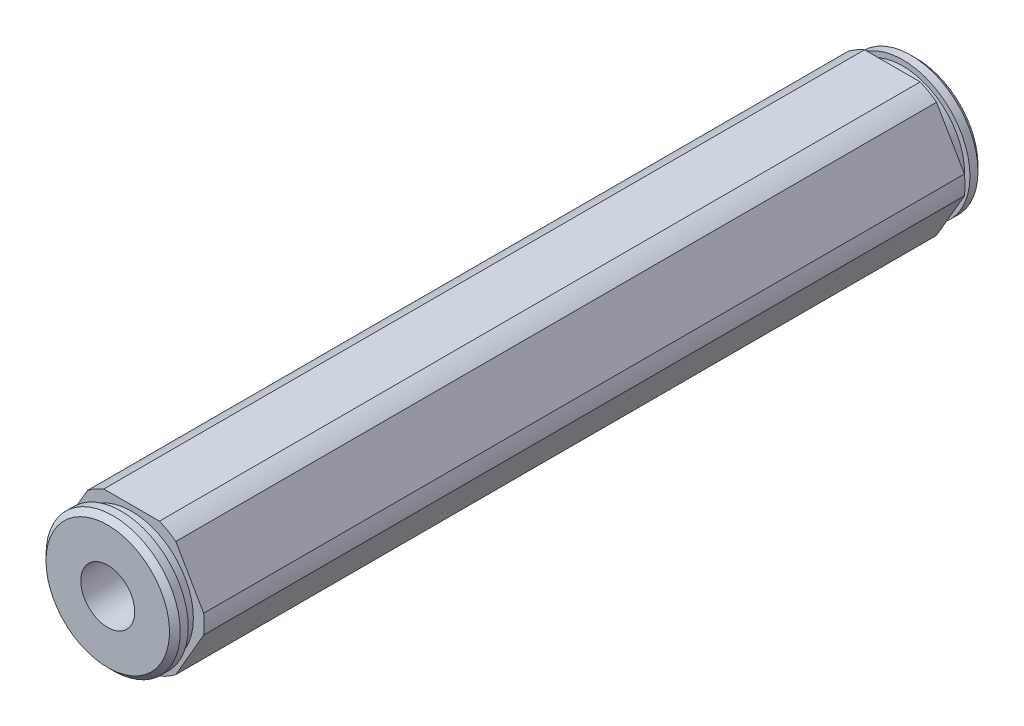
from build123d import *

# Parameters (mm, degrees)
CUT_EXTRUDE1_START = -76.5048
SKETCH3_R          = 7.62
CUT_EXTRUDE1_DEPTH = 76.5048
SKETCH4_R          = 2.5527
CUT_EXTRUDE2_DEPTH = 76.5048
CHAMFER1_SIZE      = 0.508


with BuildPart() as part:
    # Sketch2 → Revolve1 (revolve)
    with BuildSketch(Plane(origin=(0, 0, 0), x_dir=(0, 0, -1), z_dir=(1, 0, 0)), mode=Mode.PRIVATE) as revolve1_sk:
        Polygon((1.27, 6.35), (1.27, 5.842), (2.2606, 5.842), (2.2606, 7.62), (74.2442, 7.62), (74.2442, 5.842), (75.2348, 5.842), (75.2348, 6.35), (76.5048, 6.35), (76.5048, 0), (0, 0), (0, 6.35), align=None)
    revolve(revolve1_sk.sketch.rotate(Axis((0, 0, 0), (0, 0, -1)), 90), axis=Axis((0, 0, 0), (0, 0, -1)))

    # Sketch3 → Cut-Extrude1 (cut)
    with BuildSketch(Plane.XY.offset(CUT_EXTRUDE1_START)):
        Circle(SKETCH3_R)
        with BuildLine():
            Line((6.816751826, 0.893039494), (4.181770802, 5.456960506))
            ThreePointArc((4.181770802, 5.456960506), (3.4375, 5.953924651), (2.634981025, 6.35))
            Line((2.634981025, 6.35), (-2.634981025, 6.35))
            ThreePointArc((-2.634981025, 6.35), (-3.4375, 5.953924651), (-4.181770802, 5.456960506))
            Line((-4.181770802, 5.456960506), (-6.816751826, 0.893039494))
            ThreePointArc((-6.816751826, 0.893039494), (-6.875, 0), (-6.816751826, -0.893039494))
            Line((-6.816751826, -0.893039494), (-4.181770802, -5.456960506))
            ThreePointArc((-4.181770802, -5.456960506), (-3.4375, -5.953924651), (-2.634981025, -6.35))
            Line((-2.634981025, -6.35), (2.634981025, -6.35))
            ThreePointArc((2.634981025, -6.35), (3.4375, -5.953924651), (4.181770802, -5.456960506))
            Line((4.181770802, -5.456960506), (6.816751826, -0.893039494))
            ThreePointArc((6.816751826, -0.893039494), (6.875, 0), (6.816751826, 0.893039494))
        make_face(mode=Mode.SUBTRACT)
    extrude(amount=CUT_EXTRUDE1_DEPTH, mode=Mode.SUBTRACT)

    # Sketch4 → Cut-Extrude2 (cut)
    with BuildSketch(Plane(origin=(0, 0, -76.5048), x_dir=(-1, 0, 0), z_dir=(0, 0, -1))):
        with Locations(Location((0, 0, 0), (0, 0, 90))):
            Circle(SKETCH4_R)
    extrude(amount=-CUT_EXTRUDE2_DEPTH, mode=Mode.SUBTRACT)

    # Chamfer1
    chamfer1_edges = [part.edges().sort_by_distance(p)[0] for p in [
        (-6.35, 0, 0),
        (-6.35, 0, -76.5048),
    ]]
    chamfer(chamfer1_edges, length=CHAMFER1_SIZE)


solid = part.part
